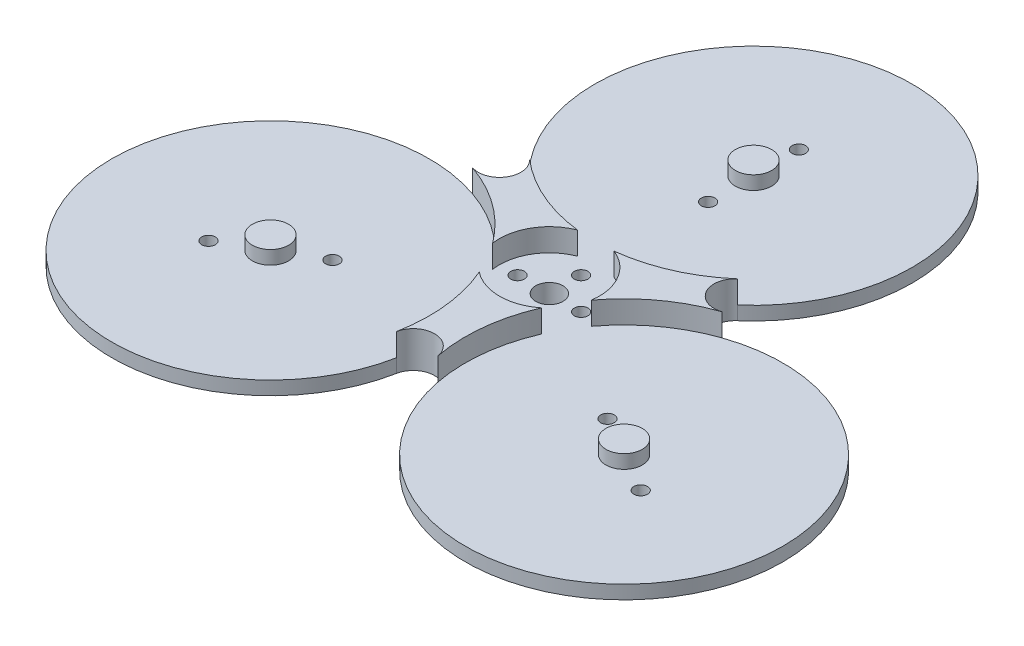
from build123d import *

# Parameters (mm, degrees)
SKETCH_1_R          = 3
SKETCH_1_R_2        = 1.5
EXTRUDE_1_DEPTH     = 8
EXTRUDE_START       = 8
SKETCH_2_R          = 10
SKETCH_2_R_2        = 1.5
SKETCH_2_R_3        = 3
EXTRUDE_2_DEPTH     = 8
CUT_EXTRUDE_START   = -5
SKETCH_3_R          = 4
CUT_EXTRUDE_2_DEPTH = 5
CHAMFER_1_SIZE      = 3
CUT_EXTRUDE_START_2 = -2
SKETCH_3_4_R        = 4
CUT_EXTRUDE_3_DEPTH = 2


with BuildPart() as part:
    # 草图1 → 凸台-拉伸1 (new body)
    with BuildSketch(Plane(origin=(0, 0, 0), x_dir=(1, 0, 0), z_dir=(0, 1, 0))):
        with BuildLine():
            ThreePointArc((0, 80), (32.794915451, 57.226754294), (22.912878475, 18.542486889))
            ThreePointArc((22.912878475, 18.542486889), (21.922333534, 12.656865167), (27.514703933, 10.571891388))
            ThreePointArc((27.514703933, 10.571891388), (65.95728072, -0.212147251), (69.282032303, -40))
            ThreePointArc((69.282032303, -40), (33.162365269, -57.014607042), (4.601825458, -29.114378278))
            ThreePointArc((4.601825458, -29.114378278), (0, -25.313730334), (-4.601825458, -29.114378278))
            ThreePointArc((-4.601825458, -29.114378278), (-33.162365269, -57.014607042), (-69.282032303, -40))
            ThreePointArc((-69.282032303, -40), (-65.95728072, -0.212147251), (-27.514703933, 10.571891388))
            ThreePointArc((-27.514703933, 10.571891388), (-21.922333534, 12.656865167), (-22.912878475, 18.542486889))
            ThreePointArc((-22.912878475, 18.542486889), (-32.794915451, 57.226754294), (0, 80))
        make_face()
        Circle(SKETCH_1_R, mode=Mode.SUBTRACT)
        with Locations((0, 7)):
            Circle(SKETCH_1_R_2, mode=Mode.SUBTRACT)
        with Locations((7, 0)):
            Circle(SKETCH_1_R_2, mode=Mode.SUBTRACT)
        with Locations((0, -7)):
            Circle(SKETCH_1_R_2, mode=Mode.SUBTRACT)
        with Locations((-7, 0)):
            Circle(SKETCH_1_R_2, mode=Mode.SUBTRACT)
        with Locations((0, 55)):
            Circle(SKETCH_1_R_2, mode=Mode.SUBTRACT)
        with Locations((0, 35)):
            Circle(SKETCH_1_R_2, mode=Mode.SUBTRACT)
        with Locations((47.631397208, -27.5)):
            Circle(SKETCH_1_R_2, mode=Mode.SUBTRACT)
        with Locations((30.310889132, -17.5)):
            Circle(SKETCH_1_R_2, mode=Mode.SUBTRACT)
        with Locations((-47.631397208, -27.5)):
            Circle(SKETCH_1_R_2, mode=Mode.SUBTRACT)
        with Locations((-30.310889132, -17.5)):
            Circle(SKETCH_1_R_2, mode=Mode.SUBTRACT)
    extrude(amount=EXTRUDE_1_DEPTH)

    # 草图2 → 凸台-拉伸2 (add)
    with BuildSketch(Plane.XZ.offset(EXTRUDE_START)):
        Circle(SKETCH_2_R)
        with Locations((-7, 0)):
            Circle(SKETCH_2_R_2, mode=Mode.SUBTRACT)
        with Locations((0, -7)):
            Circle(SKETCH_2_R_2, mode=Mode.SUBTRACT)
        with Locations((7, 0)):
            Circle(SKETCH_2_R_2, mode=Mode.SUBTRACT)
        with Locations((0, 7)):
            Circle(SKETCH_2_R_2, mode=Mode.SUBTRACT)
        Circle(SKETCH_2_R_3, mode=Mode.SUBTRACT)
    extrude(amount=-EXTRUDE_2_DEPTH)

    # 草图3 → 切除-拉伸2 (cut)
    with BuildSketch(Plane(origin=(0, 8, 0), x_dir=(1, 0, 0), z_dir=(0, 1, 0)).offset(CUT_EXTRUDE_START)):
        with BuildLine():
            ThreePointArc((-4.034710509, 10.233333333), (-9.526279442, 5.5), (-10.879681886, -1.622504869))
            ThreePointArc((-10.879681886, -1.622504869), (-69.282032303, -40), (-6.844971378, -8.610828464))
            ThreePointArc((-6.844971378, -8.610828464), (0, -11), (6.844971378, -8.610828464))
            ThreePointArc((6.844971378, -8.610828464), (69.282032303, -40), (10.879681886, -1.622504869))
            ThreePointArc((10.879681886, -1.622504869), (9.526279442, 5.5), (4.034710509, 10.233333333))
            ThreePointArc((4.034710509, 10.233333333), (0, 80), (-4.034710509, 10.233333333))
        make_face()
        with Locations((0, 45)):
            Circle(SKETCH_3_R, mode=Mode.SUBTRACT)
        with Locations((38.97114317, -22.5)):
            Circle(SKETCH_3_R, mode=Mode.SUBTRACT)
        with Locations((-38.97114317, -22.5)):
            Circle(SKETCH_3_R, mode=Mode.SUBTRACT)
    extrude(amount=CUT_EXTRUDE_2_DEPTH, mode=Mode.SUBTRACT)

    # 倒角1
    chamfer_1_edges = [part.edges().sort_by_distance(p)[0] for p in [
        (-10, 0, 0),
    ]]
    chamfer(chamfer_1_edges, length=CHAMFER_1_SIZE)

    # 草图3<4> → 切除-拉伸3 (cut)
    with BuildSketch(Plane(origin=(0, 8, 0), x_dir=(1, 0, 0), z_dir=(0, 1, 0)).offset(CUT_EXTRUDE_START_2)):
        with Locations((0, 45)):
            Circle(SKETCH_3_4_R)
        with Locations((38.97114317, -22.5)):
            Circle(SKETCH_3_4_R)
        with Locations((-38.97114317, -22.5)):
            Circle(SKETCH_3_4_R)
    extrude(amount=CUT_EXTRUDE_3_DEPTH, mode=Mode.SUBTRACT)


solid = part.part
